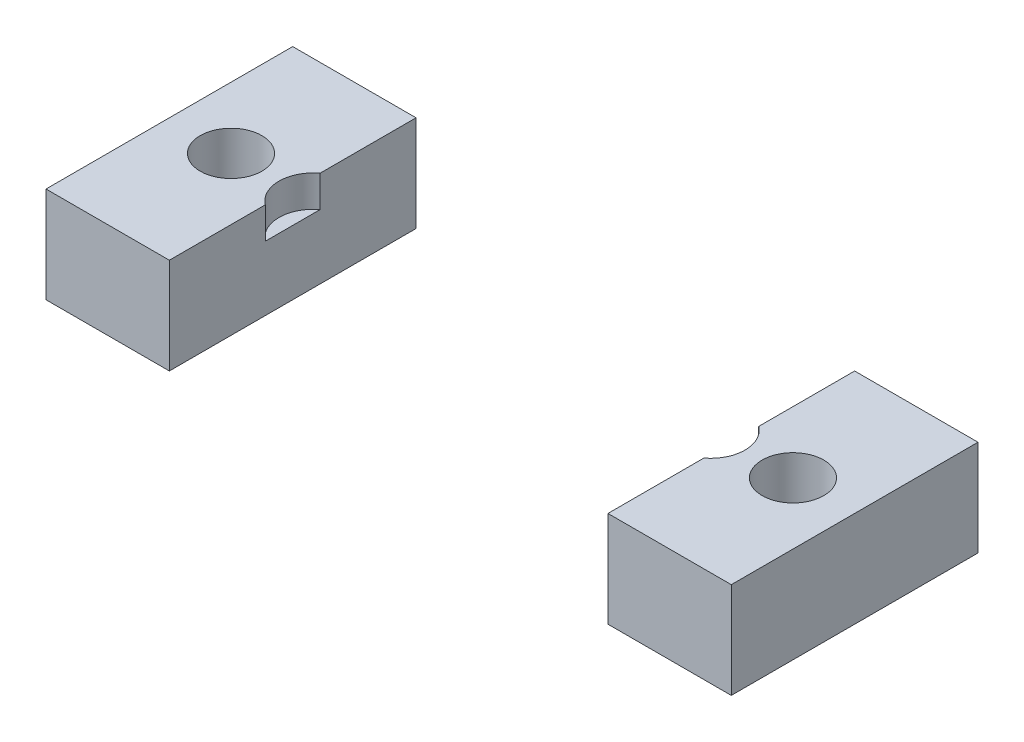
from build123d import *

# Parameters (mm, degrees)
SKETCH1_W           = 50
SKETCH1_H           = 18
BOSS_EXTRUDE2_DEPTH = 22
SKETCH4_W           = 32
SKETCH4_H           = 14
CUT_EXTRUDE1_DEPTH  = 58.515215378
SKETCH5_W           = 23
SKETCH5_H           = 18
CUT_EXTRUDE3_DEPTH  = 13
SKETCH7_W           = 50
SKETCH7_H           = 8.235017036
CUT_EXTRUDE4_DEPTH  = 58.515215378
SKETCH9_R           = 1
CUT_EXTRUDE6_DEPTH  = 54.600373133
SKETCH10_R          = 2.25
CUT_EXTRUDE7_DEPTH  = 55.895125066
CUT_EXTRUDE8_DEPTH  = 55.895125066
SKETCH14_R          = 2.5
CUT_EXTRUDE10_DEPTH = 2.3


with BuildPart() as part:
    # Sketch1 → Boss-Extrude2 (new body)
    with BuildSketch(Plane(origin=(0, 0, 0), x_dir=(1, 0, 0), z_dir=(0, 1, 0))):
        with Locations((25, 9)):
            Rectangle(SKETCH1_W, SKETCH1_H)
    extrude(amount=BOSS_EXTRUDE2_DEPTH)

    # Sketch4 → Cut-Extrude1 (cut, through all)
    with BuildSketch(Plane.XY):
        with Locations((25, 0)):
            Rectangle(SKETCH4_W, SKETCH4_H)
    extrude(amount=-CUT_EXTRUDE1_DEPTH, mode=Mode.SUBTRACT)

    # Sketch5 → Cut-Extrude3 (cut)
    with BuildSketch(Plane(origin=(0, 0, -18), x_dir=(-1, 0, 0), z_dir=(0, 0, -1))):
        with Locations((-25, 7)):
            Rectangle(SKETCH5_W, SKETCH5_H)
    extrude(amount=-CUT_EXTRUDE3_DEPTH, mode=Mode.SUBTRACT)

    # Sketch7 → Cut-Extrude4 (cut, through all)
    with BuildSketch(Plane(origin=(0, 0, -18), x_dir=(-1, 0, 0), z_dir=(0, 0, -1))):
        with Locations((-25, 17.882491482)):
            Rectangle(SKETCH7_W, SKETCH7_H)
    extrude(amount=-CUT_EXTRUDE4_DEPTH, mode=Mode.SUBTRACT)

    # Sketch9 → Cut-Extrude6 (cut, through all)
    with BuildSketch(Plane.XZ.offset(-7)):
        with Locations(Location((12, -11.5, 0), (0, 0, 270))):
            Circle(SKETCH9_R)
        with Locations(Location((38, -11.5, 0), (0, 0, 90))):
            Circle(SKETCH9_R)
    extrude(amount=-CUT_EXTRUDE6_DEPTH, mode=Mode.SUBTRACT)

    # Sketch10 → Cut-Extrude7 (cut, through all)
    with BuildSketch(Plane(origin=(0, 13.764982964, 0), x_dir=(1, 0, 0), z_dir=(0, 1, 0))):
        with Locations(Location((4.5, 9, 0), (0, 0, 270))):
            Circle(SKETCH10_R)
        with Locations(Location((45.5, 9, 0), (0, 0, 90))):
            Circle(SKETCH10_R)
    extrude(amount=-CUT_EXTRUDE7_DEPTH, mode=Mode.SUBTRACT)

    # Sketch11 → Cut-Extrude8 (cut, through all)
    with BuildSketch(Plane.XY):
        Polygon((9, 7), (50, 7), (50, 13.764982964), (0, 13.764982964), (0, 7), align=None)
    extrude(amount=-CUT_EXTRUDE8_DEPTH, mode=Mode.SUBTRACT)


with BuildPart() as cut_extrude8_piece_1:
    # of the separate pieces the step leaves, piece 1, a body of its own (cut_extrude8_pieces)
    add(part.part.solids().sort_by_distance((41, 0, 0))[0])


with BuildPart() as cut_extrude8_piece_2:
    # of the separate pieces the step leaves, piece 2, a body of its own (cut_extrude8_pieces)
    add(part.part.solids().sort_by_distance((0, 0, 0))[0])


with BuildPart() as cut_extrude10_tool:
    # Sketch14 → Cut-Extrude10 (new body)
    with BuildSketch(Plane(origin=(0, 7, 0), x_dir=(1, 0, 0), z_dir=(0, 1, 0))):
        with Locations((39.5, 9)):
            Circle(SKETCH14_R)
        with Locations((10.5, 9)):
            Circle(SKETCH14_R)
    extrude(amount=-CUT_EXTRUDE10_DEPTH)


with BuildPart() as cut_extrude8_piece_1_1:
    add(cut_extrude8_piece_1.part)

    # Cut-Extrude10: cut by cut_extrude10_tool
    add(cut_extrude10_tool.part, mode=Mode.SUBTRACT)


with BuildPart() as cut_extrude8_piece_2_1:
    add(cut_extrude8_piece_2.part)

    # Cut-Extrude10: cut by cut_extrude10_tool
    add(cut_extrude10_tool.part, mode=Mode.SUBTRACT)


solid = Compound([cut_extrude8_piece_1_1.part, cut_extrude8_piece_2_1.part])
